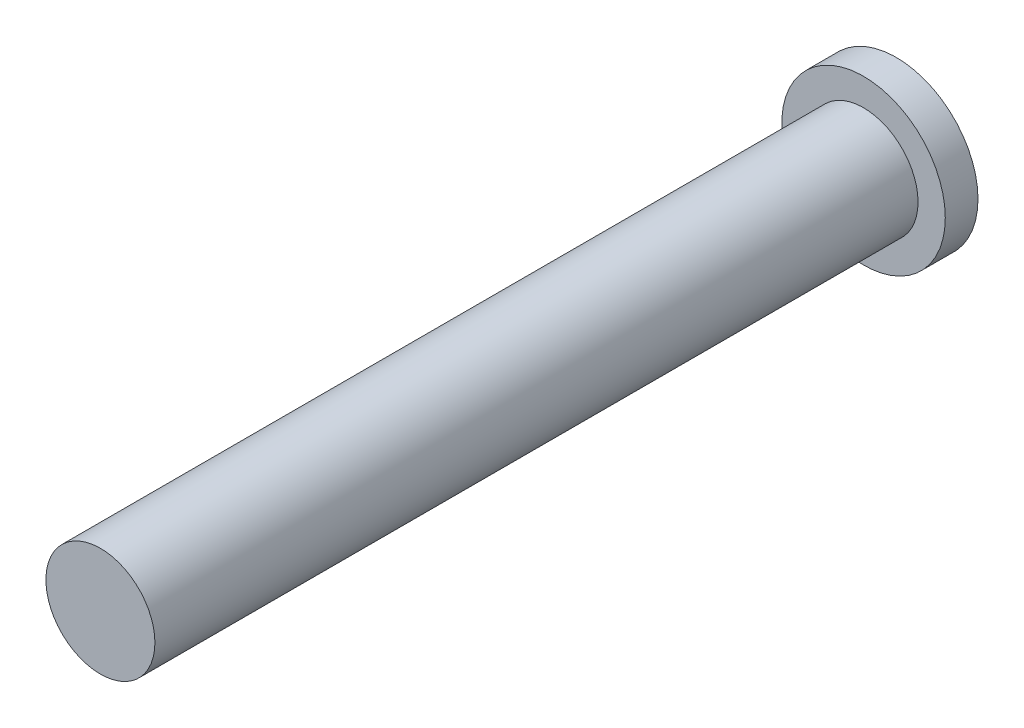
from build123d import *

# Parameters (mm, degrees)
SKETCH1_R           = 7.5
BOSS_EXTRUDE1_DEPTH = 3
SKETCH2_R           = 5
BOSS_EXTRUDE2_DEPTH = 70


with BuildPart() as part:
    # Sketch1 → Boss-Extrude1 (new body)
    with BuildSketch(Plane.XY):
        Circle(SKETCH1_R)
    extrude(amount=BOSS_EXTRUDE1_DEPTH)

    # Sketch2 → Boss-Extrude2 (add)
    with BuildSketch(Plane.XY.offset(3)):
        Circle(SKETCH2_R)
    extrude(amount=BOSS_EXTRUDE2_DEPTH)


solid = part.part
